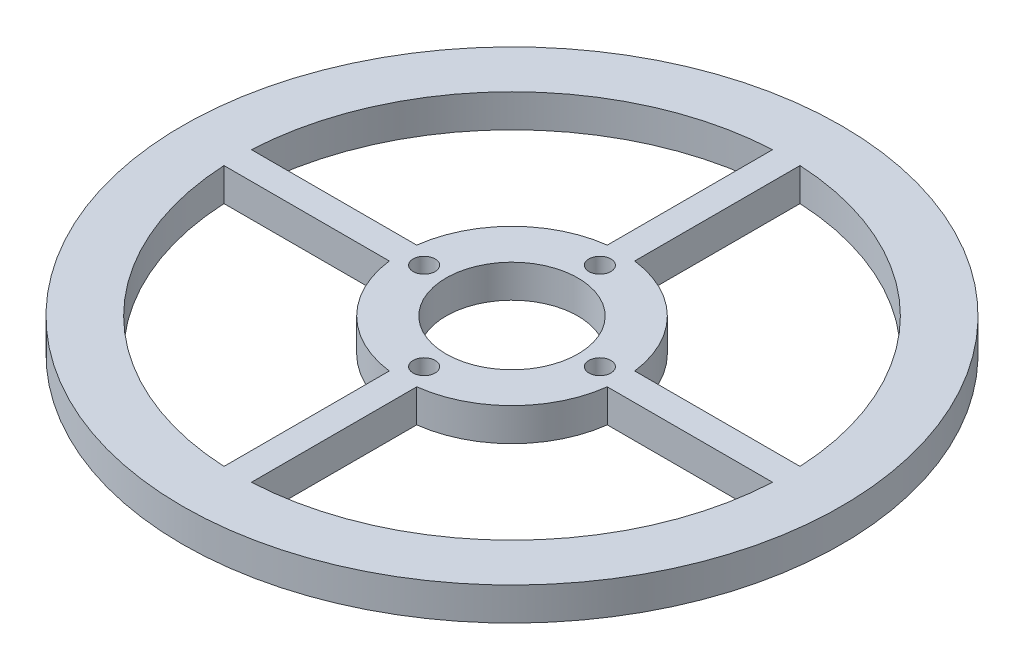
from build123d import *

# Parameters (mm, degrees)
SKETCH_1_R      = 30
SKETCH_1_R_2    = 25
SKETCH_1_R_3    = 10
SKETCH_1_R_4    = 1
SKETCH_1_R_5    = 6
EXTRUDE_1_DEPTH = 3


with BuildPart() as part:
    # 草图1 → 凸台-拉伸1 (new body)
    # profile 1 of 6: a face of its own
    with BuildSketch(Plane(origin=(0, 0, 0), x_dir=(1, 0, 0), z_dir=(0, 1, 0))):
        with Locations(Location((0, 0, 0), (0, 0, 270))):
            Circle(SKETCH_1_R)
        Circle(SKETCH_1_R_2, mode=Mode.SUBTRACT)
    # profile 2 of 6: a face of its own
    with BuildSketch(Plane(origin=(0, 0, 0), x_dir=(1, 0, 0), z_dir=(0, 1, 0))):
        with BuildLine():
            ThreePointArc((-9.921567416, -1.25), (-10, 0), (-9.921567416, 1.25))
            Line((-9.921567416, 1.25), (-24.968730444, 1.25))
            ThreePointArc((-24.968730444, 1.25), (-25, 0), (-24.968730444, -1.25))
            Line((-24.968730444, -1.25), (-9.921567416, -1.25))
        make_face()
    # profile 3 of 6: a face of its own
    with BuildSketch(Plane(origin=(0, 0, 0), x_dir=(1, 0, 0), z_dir=(0, 1, 0))):
        with BuildLine():
            ThreePointArc((-1.25, 9.921567416), (0, 10), (1.25, 9.921567416))
            Line((1.25, 9.921567416), (1.25, 24.968730444))
            ThreePointArc((1.25, 24.968730444), (0, 25), (-1.25, 24.968730444))
            Line((-1.25, 24.968730444), (-1.25, 9.921567416))
        make_face()
    # profile 4 of 6: a face of its own
    with BuildSketch(Plane(origin=(0, 0, 0), x_dir=(1, 0, 0), z_dir=(0, 1, 0))):
        Circle(SKETCH_1_R_3)
        with Locations(Location((8, 0, 0), (0, 0, 270))):
            Circle(SKETCH_1_R_4, mode=Mode.SUBTRACT)
        with Locations(Location((0, -8, 0), (0, 0, 270))):
            Circle(SKETCH_1_R_4, mode=Mode.SUBTRACT)
        with Locations(Location((-8, 0, 0), (0, 0, 270))):
            Circle(SKETCH_1_R_4, mode=Mode.SUBTRACT)
        with Locations(Location((0, 8, 0), (0, 0, 270))):
            Circle(SKETCH_1_R_4, mode=Mode.SUBTRACT)
        with Locations(Location((0, 0, 0), (0, 0, 270))):
            Circle(SKETCH_1_R_5, mode=Mode.SUBTRACT)
    # profile 5 of 6: a face of its own
    with BuildSketch(Plane(origin=(0, 0, 0), x_dir=(1, 0, 0), z_dir=(0, 1, 0))):
        with BuildLine():
            Line((24.968730444, 1.25), (9.921567416, 1.25))
            ThreePointArc((9.921567416, 1.25), (9.980372592, 0.626229125), (10, 0))
            ThreePointArc((10, 0), (9.980372592, -0.626229125), (9.921567416, -1.25))
            Line((9.921567416, -1.25), (24.968730444, -1.25))
            ThreePointArc((24.968730444, -1.25), (24.992181388, -0.625195526), (25, 0))
            ThreePointArc((25, 0), (24.992181388, 0.625195526), (24.968730444, 1.25))
        make_face()
    # profile 6 of 6: a face of its own
    with BuildSketch(Plane(origin=(0, 0, 0), x_dir=(1, 0, 0), z_dir=(0, 1, 0))):
        with BuildLine():
            Line((1.25, -24.968730444), (1.25, -9.921567416))
            ThreePointArc((1.25, -9.921567416), (0, -10), (-1.25, -9.921567416))
            Line((-1.25, -9.921567416), (-1.25, -24.968730444))
            ThreePointArc((-1.25, -24.968730444), (0, -25), (1.25, -24.968730444))
        make_face()
    extrude(amount=EXTRUDE_1_DEPTH)


solid = part.part
